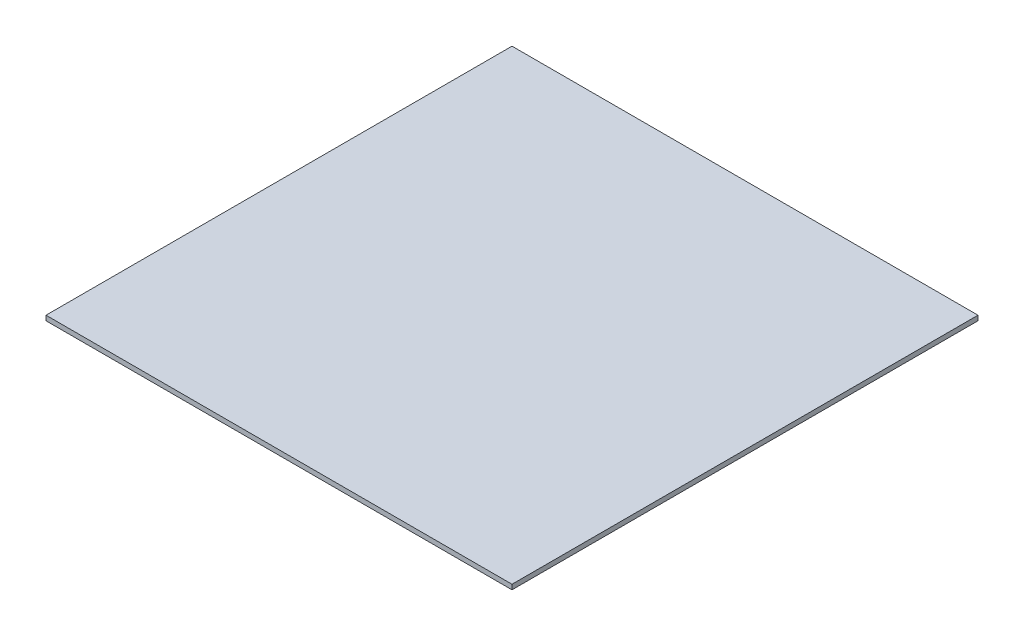
from build123d import *

# Parameters (mm, degrees)
SKETCH3_W           = 609.6
SKETCH3_H           = 609.6
BOSS_EXTRUDE1_DEPTH = 3.175


with BuildPart() as part:
    # Sketch3 → Boss-Extrude1 (new, symmetric)
    with BuildSketch(Plane(origin=(0, 0, 0), x_dir=(1, 0, 0), z_dir=(0, 1, 0))):
        Rectangle(SKETCH3_W, SKETCH3_H)
    extrude(amount=BOSS_EXTRUDE1_DEPTH, both=True)


solid = part.part
